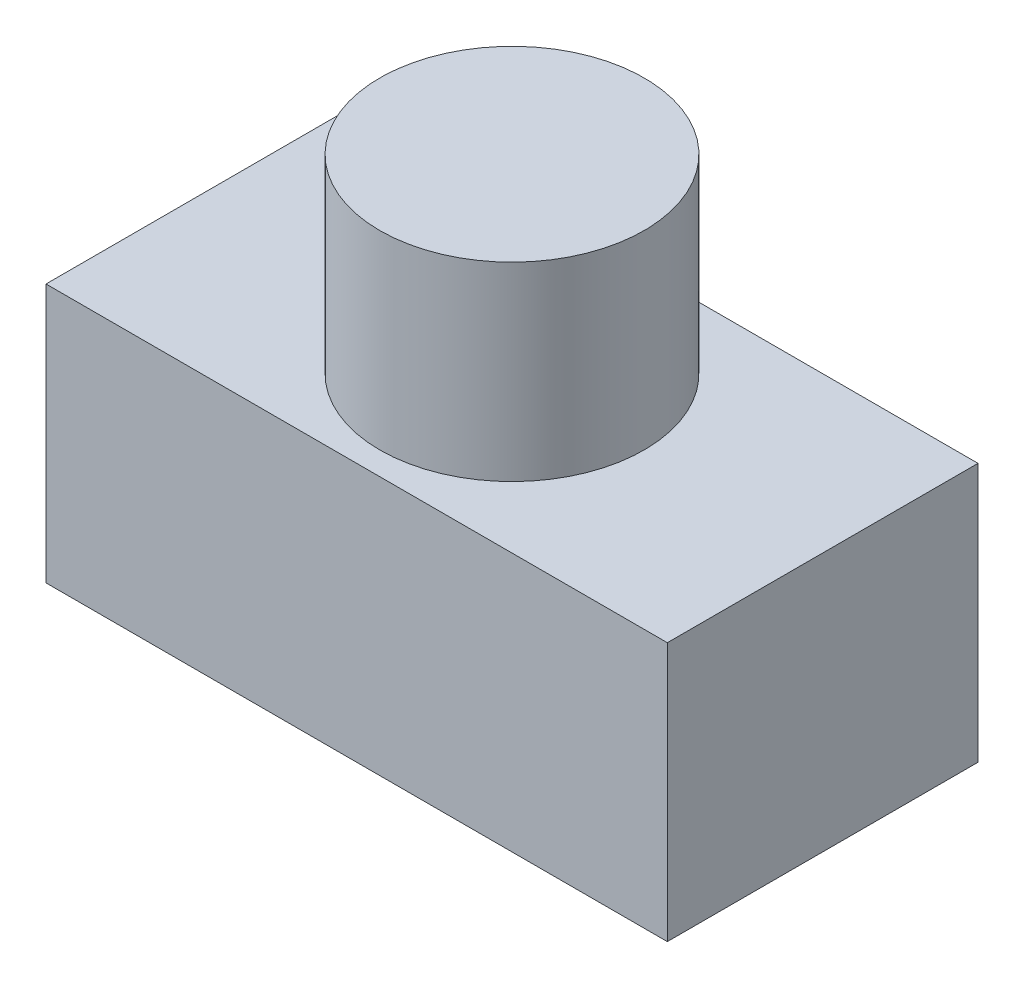
from build123d import *

# Parameters (mm, degrees)
SKETCH1_W           = 304.8
SKETCH1_H           = 127
BOSS_EXTRUDE1_DEPTH = 76.2
SKETCH4_R           = 46.960856135
CUT_EXTRUDE3_DEPTH  = 213.51164674
SKETCH5_R           = 64.855004159
BOSS_EXTRUDE2_DEPTH = 93.218


with BuildPart() as part:
    # Sketch1 → Boss-Extrude1 (new, symmetric)
    with BuildSketch(Plane.XY):
        Rectangle(SKETCH1_W, SKETCH1_H)
    extrude(amount=BOSS_EXTRUDE1_DEPTH, both=True)

    # Sketch4 → Cut-Extrude3 (cut, through all)
    with BuildSketch(Plane(origin=(0, 63.5, 0), x_dir=(1, 0, 0), z_dir=(0, 1, 0))):
        with Locations(Location((0, 0, 0), (0, 0, 270))):
            Circle(SKETCH4_R)
    extrude(amount=-CUT_EXTRUDE3_DEPTH, mode=Mode.SUBTRACT)

    # Sketch5 → Boss-Extrude2 (add)
    with BuildSketch(Plane(origin=(0, 63.5, 0), x_dir=(1, 0, 0), z_dir=(0, 1, 0))):
        with Locations(Location((0, 0, 0), (0, 0, 270))):
            Circle(SKETCH5_R)
    extrude(amount=BOSS_EXTRUDE2_DEPTH)


solid = part.part
